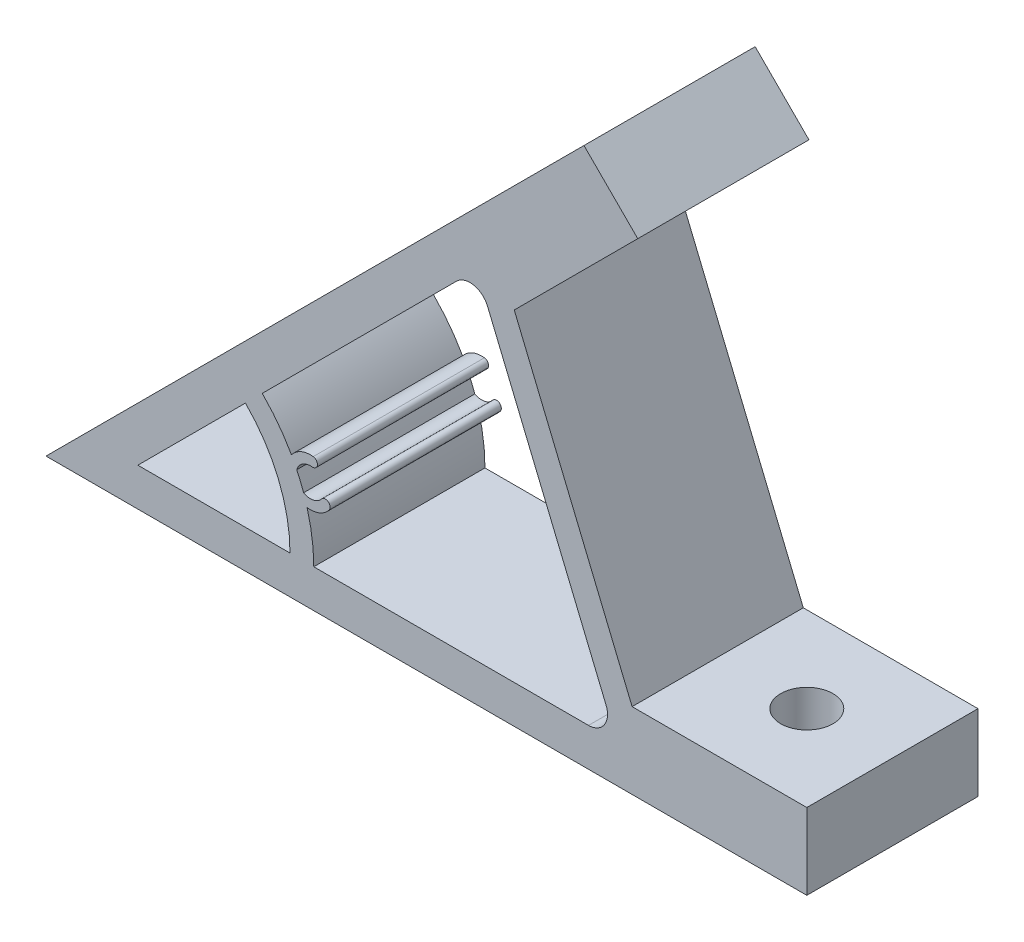
from build123d import *

# Parameters (mm, degrees)
EXTRUDE_1_DEPTH     = 18
SKETCH_2_R          = 2.75
CUT_EXTRUDE_1_DEPTH = 28
SKETCH_3_R          = 2.75
CUT_EXTRUDE_2_DEPTH = 28


with BuildPart() as part:
    # 草图1 → 凸台-拉伸1 (new body)
    # profile 1 of 2: a face of its own
    with BuildSketch(Plane.XY):
        Polygon((80, 0), (80, 8), (61.629823519, 8), (49.235720383, 37.922011884), (62.225396744, 50.911688245), (56.568542495, 56.568542495), (0, 0), align=None)
        with BuildLine():
            ThreePointArc((46.428217999, 36.860544425), (44.970639578, 38.056748121), (43.166245372, 37.509391123))
            Line((43.166245372, 37.509391123), (9.656854249, 4))
            Line((9.656854249, 4), (57.046289642, 4))
            ThreePointArc((57.046289642, 4), (58.709228866, 4.888859534), (58.894048707, 6.765366865))
            Line((58.894048707, 6.765366865), (46.428217999, 36.860544425))
        make_face(mode=Mode.SUBTRACT)
    # profile 2 of 2: a face of its own
    with BuildSketch(Plane.XY):
        with BuildLine():
            Line((25.656854249, 4), (28.156854249, 4))
            ThreePointArc((28.156854249, 4), (27.980871323, 6.54566264), (27.456270652, 9.042893586))
            ThreePointArc((27.456270652, 9.042893586), (28.736340858, 9.197193956), (29.769286429, 9.968823258))
            ThreePointArc((29.769286429, 9.968823258), (29.686739249, 10.671095259), (28.984467248, 10.588548079))
            ThreePointArc((28.984467248, 10.588548079), (28.105812081, 10.048151022), (27.085956296, 10.202934937))
            ThreePointArc((27.085956296, 10.202934937), (26.748625601, 11.079643499), (26.367227854, 11.93809889))
            ThreePointArc((26.367227854, 11.93809889), (26.978926039, 12.768694587), (27.982347489, 13.007879191))
            ThreePointArc((27.982347489, 13.007879191), (28.537298455, 13.446090814), (28.099086832, 14.001041779))
            ThreePointArc((28.099086832, 14.001041779), (26.823059701, 13.816263273), (25.808806541, 13.020223788))
            ThreePointArc((25.808806541, 13.020223788), (24.413946296, 15.156981417), (22.738329701, 17.081475452))
            Line((22.738329701, 17.081475452), (20.970562748, 15.313708499))
            ThreePointArc((20.970562748, 15.313708499), (24.43892677, 10.122934918), (25.656854249, 4))
        make_face()
    extrude(amount=EXTRUDE_1_DEPTH)

    # 草图2 → 切除-拉伸1 (cut)
    with BuildSketch(Plane(origin=(0, 8, 0), x_dir=(1, 0, 0), z_dir=(0, 1, 0))):
        with Locations(Location((71, -9, 0), (0, 0, 180))):
            Circle(SKETCH_2_R)
    extrude(amount=-CUT_EXTRUDE_1_DEPTH, mode=Mode.SUBTRACT)

    # 草图3 → 切除-拉伸2 (cut)
    with BuildSketch(Plane(origin=(5.656854249, -5.656854249, 0), x_dir=(0, 0, -1), z_dir=(0.7071067811865488, -0.7071067811865464, 0))):
        with Locations(Location((-9, 71, 0), (0, 0, 90))):
            Circle(SKETCH_3_R)
    extrude(amount=-CUT_EXTRUDE_2_DEPTH, mode=Mode.SUBTRACT)


solid = part.part
